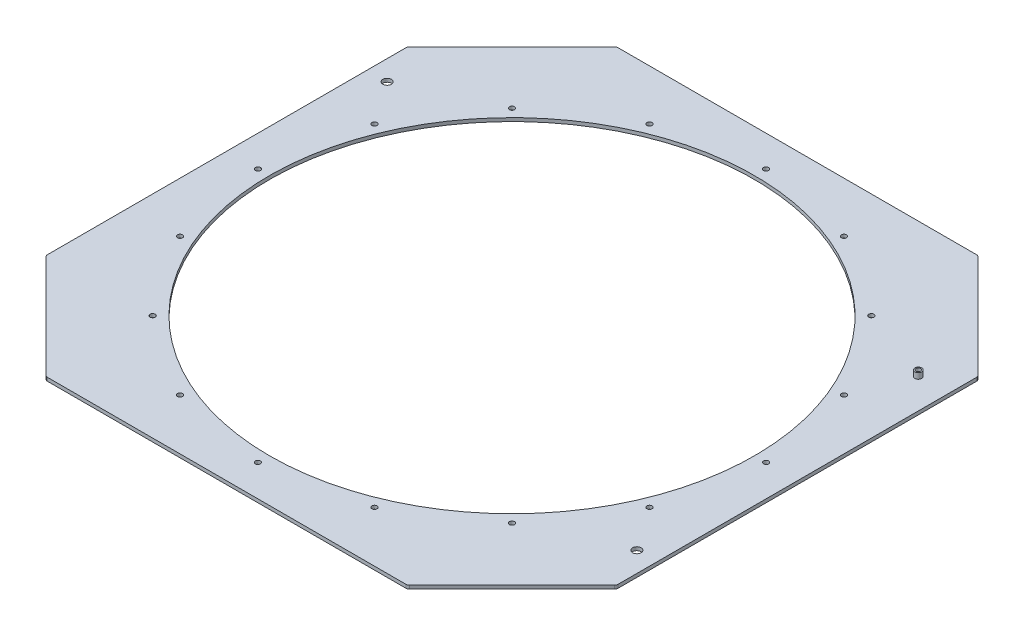
from build123d import *

# Parameters (mm, degrees)
BOSS_EXTRUDE1_DEPTH = 6
SKETCH2_R           = 422.5
CUT_EXTRUDE1_DEPTH  = 6
SKETCH3_R           = 4.5
CUT_EXTRUDE2_DEPTH  = 6
CIRPATTERN1_COUNT   = 16
SKETCH4_R           = 3
CUT_EXTRUDE3_DEPTH  = 10
SKETCH5_R           = 7.5
CUT_EXTRUDE4_DEPTH  = 10
FILLET1_R           = 6
SKETCH6_R           = 6
SKETCH6_R_2         = 4
EXTRUDE_THIN1_DEPTH = 10


with BuildPart() as part:
    # Sketch1 → Boss-Extrude1 (new body)
    with BuildSketch(Plane(origin=(0, 0, 0), x_dir=(1, 0, 0), z_dir=(0, 1, 0))):
        Polygon((315.066450454, 496.5), (497.5, 314.066450454), (497.5, -315.066450454), (315.066450454, -497.5), (-314.066450454, -497.5), (-496.5, -315.066450454), (-496.5, 314.066450454), (-314.066450454, 496.5), align=None)
    extrude(amount=BOSS_EXTRUDE1_DEPTH)

    # Sketch2 → Cut-Extrude1 (cut)
    with BuildSketch(Plane(origin=(0, 6, 0), x_dir=(1, 0, 0), z_dir=(0, 1, 0))):
        with Locations(Location((0, 0, 0), (0, 0, 270))):
            Circle(SKETCH2_R)
    extrude(amount=-CUT_EXTRUDE1_DEPTH, mode=Mode.SUBTRACT)

    # Sketch3 → Cut-Extrude2 (cut)
    with BuildSketch(Plane(origin=(0, 6, 0), x_dir=(1, 0, 0), z_dir=(0, 1, 0))):
        with Locations(Location((0, 442.5, 0), (0, 0, 270))):
            Circle(SKETCH3_R)
    cut_extrude2 = extrude(amount=-CUT_EXTRUDE2_DEPTH, mode=Mode.SUBTRACT)

    # CirPattern1: Cut-Extrude2 ×16 about axis
    cirpattern1_axis = Axis((0, 0, 0), (0, 1, 0))
    for i in range(1, CIRPATTERN1_COUNT):
        add(cut_extrude2.rotate(cirpattern1_axis, i * 360 / CIRPATTERN1_COUNT), mode=Mode.SUBTRACT)

    # Sketch4 → Cut-Extrude3 (cut)
    with BuildSketch(Plane(origin=(0, 6, 0), x_dir=(1, 0, 0), z_dir=(0, 1, 0))):
        with Locations(Location((445.5, 262.066450454, 0), (0, 0, 270))):
            Circle(SKETCH4_R)
    extrude(amount=-CUT_EXTRUDE3_DEPTH, mode=Mode.SUBTRACT)

    # Sketch5 → Cut-Extrude4 (cut)
    with BuildSketch(Plane(origin=(0, 6, 0), x_dir=(1, 0, 0), z_dir=(0, 1, 0))):
        with Locations(Location((-461.5, 244.066450454, 0), (0, 0, 270))):
            Circle(SKETCH5_R)
        with Locations(Location((462.5, -245.066450454, 0), (0, 0, 270))):
            Circle(SKETCH5_R)
    extrude(amount=-CUT_EXTRUDE4_DEPTH, mode=Mode.SUBTRACT)

    # Fillet1
    fillet1_edges = [part.edges().sort_by_distance(p)[0] for p in [
        (315.066450454, 3, -496.5),
        (497.5, 3, -314.066450454),
        (497.5, 3, 315.066450454),
        (315.066450454, 3, 497.5),
        (-314.066450454, 3, 497.5),
        (-496.5, 3, 315.066450454),
        (-496.5, 3, -314.066450454),
        (-314.066450454, 3, -496.5),
    ]]
    fillet(fillet1_edges, radius=FILLET1_R)

    # Sketch6 → Extrude-Thin1 (add)
    with BuildSketch(Plane(origin=(0, 6, 0), x_dir=(1, 0, 0), z_dir=(0, 1, 0))):
        with Locations((445.5, 262.066450454)):
            Circle(SKETCH6_R)
        with Locations((445.5, 262.066450454)):
            Circle(SKETCH6_R_2, mode=Mode.SUBTRACT)
    extrude(amount=EXTRUDE_THIN1_DEPTH)


solid = part.part
